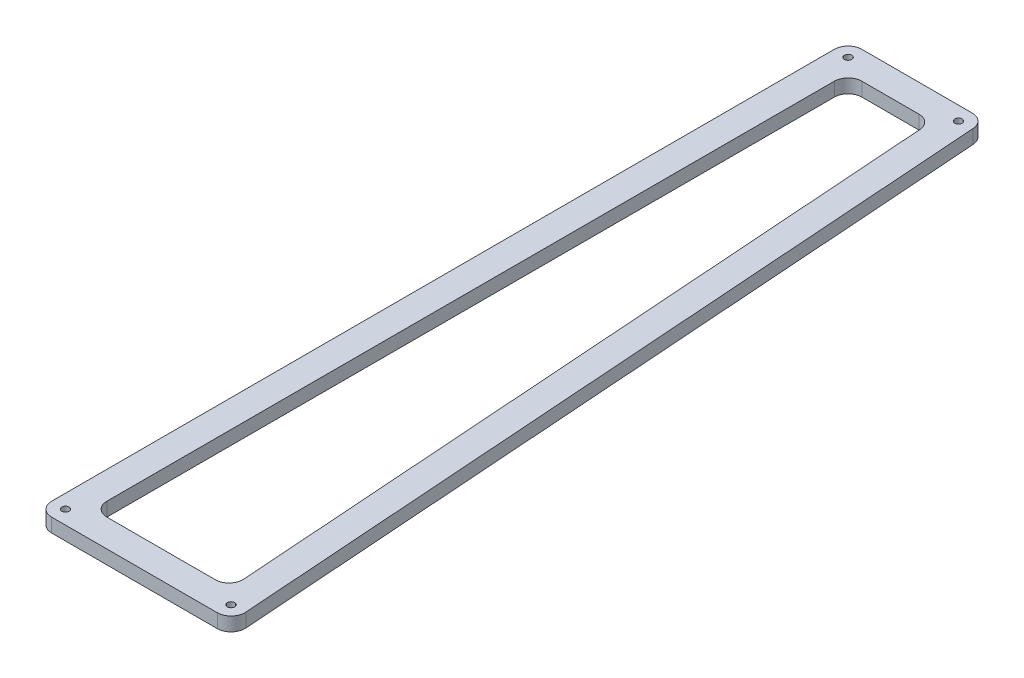
from build123d import *

# Parameters (mm, degrees)
SKETCH1_R           = 0.8509
BOSS_EXTRUDE1_DEPTH = 3.175


with BuildPart() as part:
    # Sketch1 → Boss-Extrude1 (new body)
    with BuildSketch(Plane(origin=(0, 0, 0), x_dir=(1, 0, 0), z_dir=(0, 1, 0))):
        with BuildLine():
            Line((-3.175, 180.086), (-3.175, 0))
            ThreePointArc((-3.175, 0), (-2.24506403, -2.24506403), (0, -3.175))
            Line((0, -3.175), (38.1, -3.175))
            ThreePointArc((38.1, -3.175), (40.422688983, -2.164657221), (41.267134161, 0.223352198))
            Line((41.267134161, 0.223352198), (28.567134161, 180.309352198))
            ThreePointArc((28.567134161, 180.309352198), (27.564657221, 182.408688983), (25.4, 183.261))
            Line((25.4, 183.261), (0, 183.261))
            ThreePointArc((0, 183.261), (-2.24506403, 182.33106403), (-3.175, 180.086))
        make_face()
        with Locations(Location((0, 180.086, 0), (0, 0, 270))):
            Circle(SKETCH1_R, mode=Mode.SUBTRACT)
        with Locations(Location((25.4, 180.086, 0), (0, 0, 270))):
            Circle(SKETCH1_R, mode=Mode.SUBTRACT)
        with Locations(Location((38.1, 0, 0), (0, 0, 270))):
            Circle(SKETCH1_R, mode=Mode.SUBTRACT)
        with Locations(Location((0, 0, 0), (0, 0, 270))):
            Circle(SKETCH1_R, mode=Mode.SUBTRACT)
        with BuildLine():
            Line((3.175, 173.736), (3.175, 6.35))
            ThreePointArc((3.175, 6.35), (4.10493597, 4.10493597), (6.35, 3.175))
            Line((6.35, 3.175), (31.286415429, 3.175))
            ThreePointArc((31.286415429, 3.175), (33.609104413, 4.185342779), (34.453549591, 6.573352198))
            Line((34.453549591, 6.573352198), (22.649177235, 173.959352198))
            ThreePointArc((22.649177235, 173.959352198), (21.646700295, 176.058688983), (19.482043074, 176.911))
            Line((19.482043074, 176.911), (6.35, 176.911))
            ThreePointArc((6.35, 176.911), (4.10493597, 175.98106403), (3.175, 173.736))
        make_face(mode=Mode.SUBTRACT)
    extrude(amount=BOSS_EXTRUDE1_DEPTH)


solid = part.part
